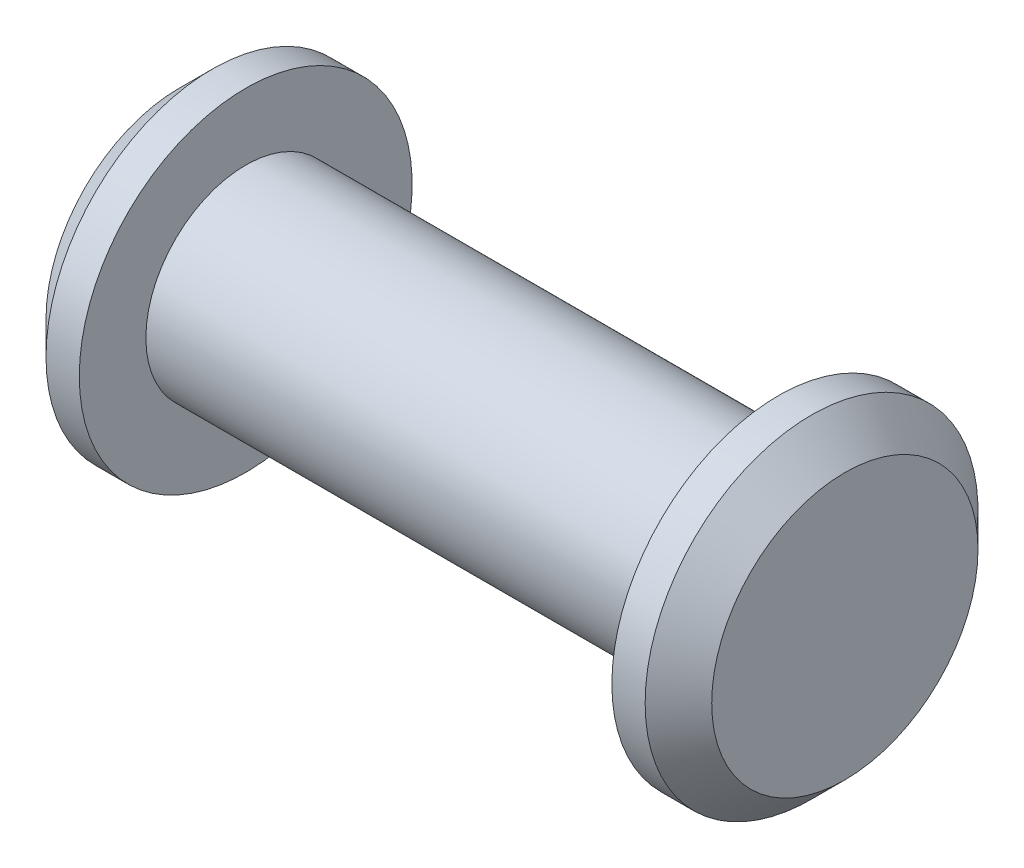
from build123d import *


with BuildPart() as part:
    # Sketch1 → Revolve1 (revolve)
    with BuildSketch(Plane.XY, mode=Mode.PRIVATE) as revolve1_sk:
        Polygon((-20, 0), (-20, 8), (-18, 10), (-16, 10), (-16, 6), (16, 6), (16, 10), (18, 10), (20, 8), (20, 0), align=None)
    revolve(revolve1_sk.sketch.rotate(Axis((0, 0, 0), (1, 0, 0)), 90), axis=Axis((0, 0, 0), (1, 0, 0)))


solid = part.part
